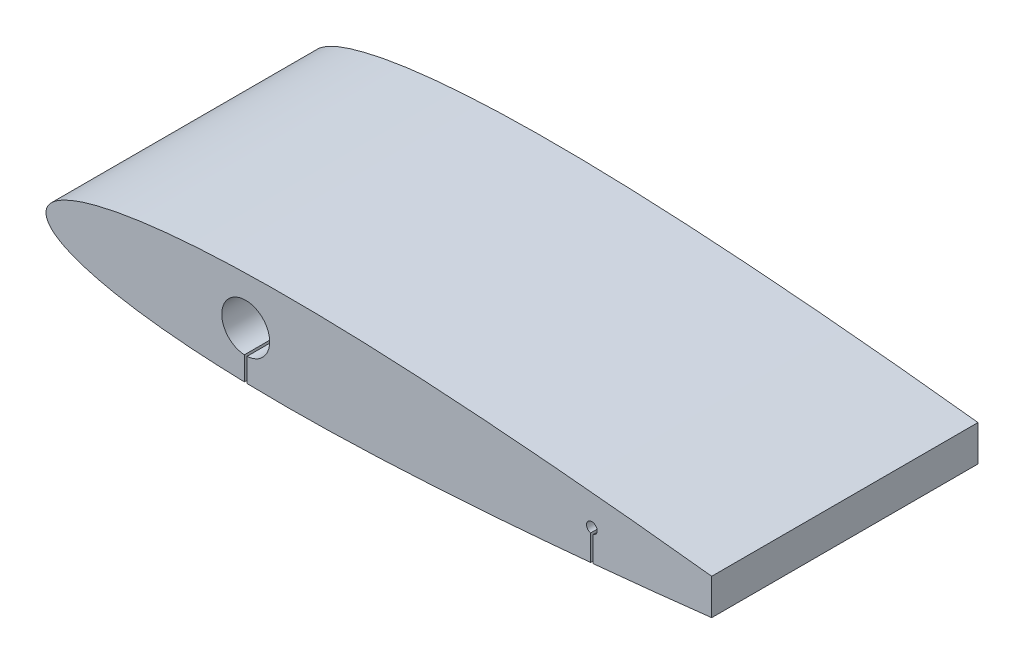
from build123d import *

# Parameters (mm, degrees)
BOSS_EXTRUDE1_DEPTH     = 100
SKETCH7_R               = 9
SKETCH7_R_2             = 2
CUT_EXTRUDE7_DEPTH      = 321.037698694
CUT_EXTRUDE8_DEPTH      = 20
CUT_EXTRUDE8_DEPTH_BACK = 20
SKETCH9_W               = 50
SKETCH9_H               = 100
SKETCH10_W              = 1
SKETCH10_H              = 100
CUT_EXTRUDE9_DEPTH      = 20
SKETCH11_W              = 44.16
SKETCH11_H              = 34.63
CUT_EXTRUDE10_DEPTH     = 270.859460782


with BuildPart() as part:
    # Sketch5 → Boss-Extrude1 (new body)
    with BuildSketch(Plane.XY):
        with BuildLine():
            Line((300, 0.378), (300, -0.378))
            add(Edge.make_bspline(
                [(300, 0.378), (299.270406424, 0.479445822), (297.234667094, 0.762503754), (293.659650161, 1.257673506), (289.112411795, 1.874242443), (284.080816659, 2.54451744), (278.752044218, 3.238122316), (273.265899022, 3.934946436), (267.705955472, 4.629019943), (262.11456302, 5.313069107), (256.508348909, 5.982191812), (250.891738994, 6.637990809), (245.269556965, 7.281779235), (239.647345349, 7.912232764), (234.025130107, 8.526992046), (228.399087903, 9.126229764), (222.768257645, 9.713077606), (217.135920793, 10.28745981), (211.505410154, 10.846941084), (205.877619803, 11.391642827), (200.251512374, 11.920884624), (194.626420536, 12.434617078), (189.002797137, 12.931911809), (183.381530938, 13.413097581), (177.763225616, 13.876376701), (172.148301533, 14.321237194), (166.537529462, 14.747820918), (160.931736194, 15.154228144), (155.33170885, 15.539100856), (149.737538345, 15.902649564), (144.148688279, 16.241846119), (138.565679604, 16.557420546), (132.990859803, 16.847397555), (127.42743944, 17.110211679), (121.877619637, 17.343891718), (116.340758577, 17.545256813), (110.815476382, 17.71267912), (105.301273398, 17.844497938), (99.800570116, 17.940091813), (94.317435844, 17.996590439), (88.855764067, 18.010124458), (83.418647975, 17.97923384), (78.008480827, 17.899160713), (72.628455365, 17.767033787), (67.282738746, 17.579413934), (61.977364895, 17.331515489), (56.720691016, 17.021032651), (51.525175322, 16.64095807), (46.408202619, 16.190188591), (41.394176065, 15.661669099), (36.515671087, 15.053963784), (31.819009441, 14.365623605), (27.366164829, 13.603475684), (23.235217954, 12.782583444), (19.502642451, 11.920250751), (16.218271393, 11.044597796), (13.389186016, 10.175076255), (10.984929333, 9.333498715), (8.961561478, 8.522062882), (7.267292053, 7.746976002), (5.846052466, 7.010625622), (4.647711085, 6.300634033), (3.628235251, 5.606513668), (2.751909197, 4.926635252), (2.00625736, 4.249917259), (1.390586137, 3.570259492), (0.901000435, 2.890942252), (0.529275535, 2.220219273), (0.260479537, 1.566458936), (0.085712654, 0.931035928), (-0.003509247, 0.308981015), (-0.003509247, -0.308981015), (0.085712654, -0.931035928), (0.260479537, -1.566458936), (0.529275535, -2.220219273), (0.901000435, -2.890942252), (1.390586137, -3.570259492), (2.00625736, -4.249917259), (2.751909197, -4.926635252), (3.628235251, -5.606513668), (4.647711085, -6.300634033), (5.846052466, -7.010625622), (7.267292053, -7.746975999), (8.961561475, -8.522062895), (10.984929344, -9.333498651), (13.389185965, -10.175076559), (16.21827163, -11.044596377), (19.502641361, -11.92025728), (23.235222799, -12.782554413), (27.366127559, -13.603596161), (31.819075008, -14.365113363), (36.515634637, -15.054106097), (41.394182204, -15.661628887), (46.408200924, -16.190199694), (51.525175786, -16.640955027), (56.720690889, -17.02103348), (61.977364929, -17.331515263), (67.282738736, -17.579413995), (72.628455367, -17.767033771), (78.008480826, -17.899160717), (83.418647975, -17.979233839), (88.855764067, -18.010124458), (94.317435844, -17.996590438), (99.800570116, -17.940091813), (105.301273398, -17.844497938), (110.815476382, -17.71267912), (116.340758577, -17.545256813), (121.877619637, -17.343891718), (127.42743944, -17.110211679), (132.990859803, -16.847397555), (138.565679604, -16.557420546), (144.148688279, -16.241846119), (149.737538345, -15.902649564), (155.33170885, -15.539100856), (160.931736194, -15.154228144), (166.537529462, -14.747820918), (172.148301533, -14.321237194), (177.763225616, -13.876376701), (183.381530938, -13.413097581), (189.002797137, -12.931911809), (194.626420536, -12.434617078), (200.251512374, -11.920884624), (205.877619803, -11.391642827), (211.505410154, -10.846941084), (217.135920793, -10.28745981), (222.768257645, -9.713077606), (228.399087903, -9.126229764), (234.025130107, -8.526992046), (239.647345349, -7.912232764), (245.269556965, -7.281779235), (250.891738994, -6.637990809), (256.508348909, -5.982191812), (262.11456302, -5.313069107), (267.705955472, -4.629019943), (273.265899022, -3.934946436), (278.752044218, -3.238122316), (284.080816659, -2.54451744), (289.112411795, -1.874242443), (293.659650161, -1.257673506), (297.234667094, -0.762503754), (299.270406424, -0.479445822), (300, -0.378)],
                knots=[0, 0, 0, 0, 0.003612221, 0.010078953, 0.017698618, 0.026115111, 0.034970966, 0.04405038, 0.05323433, 0.06244757, 0.071673993, 0.080921319, 0.090177538, 0.099424342, 0.108664441, 0.117912199, 0.127169502, 0.136426595, 0.145675426, 0.154916495, 0.164153237, 0.173386649, 0.182615736, 0.191838089, 0.201053134, 0.210260393, 0.219458942, 0.228646747, 0.237822316, 0.246985224, 0.256137384, 0.265279416, 0.27440695, 0.283512193, 0.292591781, 0.301646285, 0.310681793, 0.319699068, 0.32869452, 0.33766016, 0.346588583, 0.355477412, 0.364322937, 0.373121614, 0.381867635, 0.390553005, 0.399166026, 0.407689628, 0.416098119, 0.424354887, 0.432412429, 0.440204728, 0.447630505, 0.454563638, 0.460855379, 0.466413319, 0.47122861, 0.475365774, 0.47890126, 0.481915077, 0.484498872, 0.486747127, 0.488741252, 0.490543179, 0.492182104, 0.493672831, 0.495031908, 0.49627906, 0.497424737, 0.498490166, 0.499502758, 0.500497254, 0.501509846, 0.502575275, 0.503720952, 0.504968104, 0.506327181, 0.507817908, 0.509456832, 0.51125876, 0.513252884, 0.51550114, 0.518084934, 0.521098752, 0.524634237, 0.528771401, 0.533586692, 0.539144632, 0.545436374, 0.552369506, 0.5597952, 0.567587571, 0.575645113, 0.583901881, 0.592310372, 0.600833974, 0.609446995, 0.618132365, 0.626878386, 0.635677063, 0.644522588, 0.653411417, 0.66233984, 0.67130548, 0.680300932, 0.689318207, 0.698353715, 0.707408219, 0.716487807, 0.72559305, 0.734720584, 0.743862616, 0.753014776, 0.762177684, 0.771353253, 0.780541058, 0.789739607, 0.798946866, 0.808161911, 0.817384264, 0.826613351, 0.835846763, 0.845083505, 0.854324574, 0.863573405, 0.872830498, 0.882087801, 0.891335559, 0.900575658, 0.909822462, 0.919078681, 0.928326007, 0.93755243, 0.94676567, 0.95594962, 0.965029034, 0.973884889, 0.982301382, 0.989921047, 0.996387779, 1, 1, 1, 1], degree=3))
        make_face()
    extrude(amount=BOSS_EXTRUDE1_DEPTH)

    # Sketch7 → Cut-Extrude7 (cut, through all)
    with BuildSketch(Plane.XY.offset(110)):
        with Locations((75, 0)):
            Circle(SKETCH7_R)
        with Locations((205, 0)):
            Circle(SKETCH7_R_2)
    extrude(amount=-CUT_EXTRUDE7_DEPTH, mode=Mode.SUBTRACT)

    # Sketch9 → Cut-Extrude8 (cut, two sides: drawn at the far end of the back side and taken through both)
    with BuildSketch(Plane(origin=(0, 0, 0), x_dir=(1, 0, 0), z_dir=(0, 1, 0)).offset(-CUT_EXTRUDE8_DEPTH_BACK)):
        with Locations((275, -50)):
            Rectangle(SKETCH9_W, SKETCH9_H)
    extrude(amount=CUT_EXTRUDE8_DEPTH + CUT_EXTRUDE8_DEPTH_BACK, mode=Mode.SUBTRACT)

    # Sketch10 → Cut-Extrude9 (cut)
    with BuildSketch(Plane(origin=(0, 0, 0), x_dir=(1, 0, 0), z_dir=(0, 1, 0))):
        with Locations((75.000068065, -50)):
            Rectangle(SKETCH10_W, SKETCH10_H)
        with Locations((205.000068065, -50)):
            Rectangle(SKETCH10_W, SKETCH10_H)
    extrude(amount=-CUT_EXTRUDE9_DEPTH, mode=Mode.SUBTRACT)

    # Sketch11 → Cut-Extrude10 (cut, through all)
    with BuildSketch(Plane(origin=(0, 0, 0), x_dir=(1, 0, 0), z_dir=(0, 1, 0))):
        with Locations((175, -50)):
            Rectangle(SKETCH11_W, SKETCH11_H)
    extrude(amount=-CUT_EXTRUDE10_DEPTH, mode=Mode.SUBTRACT)


solid = part.part
